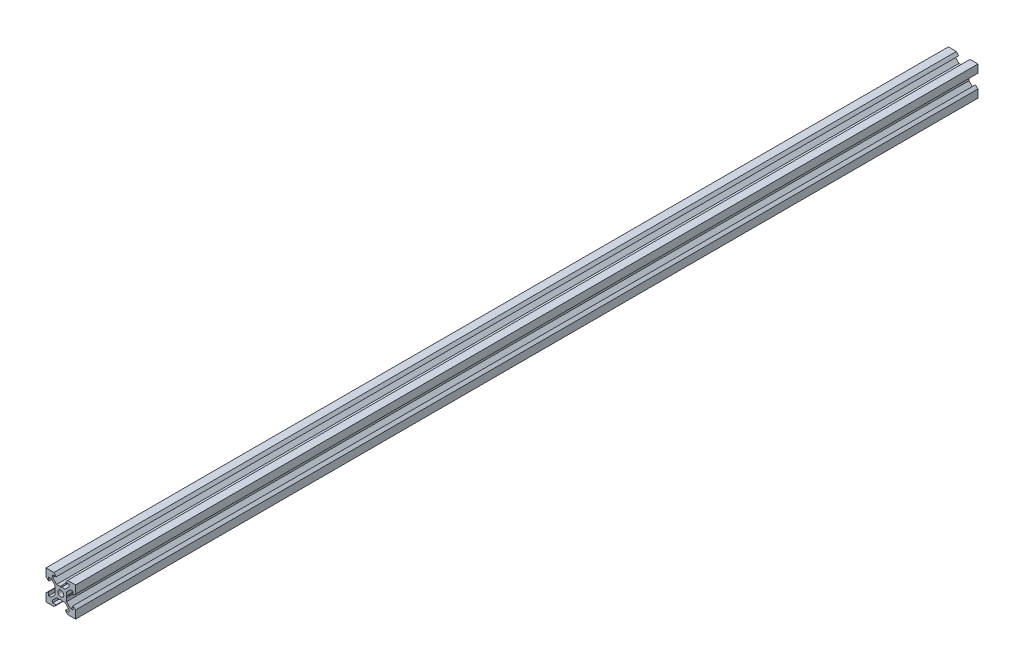
from build123d import *

# Parameters (mm, degrees)
SKETCH1_R           = 2
BOSS_EXTRUDE1_DEPTH = 304.65


with BuildPart() as part:
    # Sketch1 → Boss-Extrude1 (new, symmetric)
    with BuildSketch(Plane.XY):
        Polygon((10, 10), (10, 4.610379336), (8.2, 3.1), (8.2, 5.5), (6.560660172, 5.5), (3.9, 2.839339828), (3.9, 0.519615242), (3.6, 0), (3.9, -0.519615242), (3.9, -2.839339828), (6.560660172, -5.5), (8.2, -5.5), (8.2, -3.1), (10, -4.610379336), (10, -10), (4.610379336, -10), (3.1, -8.2), (5.5, -8.2), (5.5, -6.560660172), (2.839339828, -3.9), (0.519615242, -3.9), (0, -3.6), (-0.519615242, -3.9), (-2.839339828, -3.9), (-5.5, -6.560660172), (-5.5, -8.2), (-3.1, -8.2), (-4.610379336, -10), (-10, -10), (-10, -4.610379336), (-8.2, -3.1), (-8.2, -5.5), (-6.560660172, -5.5), (-3.9, -2.839339828), (-3.9, -0.519615242), (-3.6, 0), (-3.9, 0.519615242), (-3.9, 2.839339828), (-6.560660172, 5.5), (-8.2, 5.5), (-8.2, 3.1), (-10, 4.610379336), (-10, 10), (-4.610379336, 10), (-3.1, 8.2), (-5.5, 8.2), (-5.5, 6.560660172), (-2.839339828, 3.9), (-0.519615242, 3.9), (0, 3.6), (0.519615242, 3.9), (2.839339828, 3.9), (5.5, 6.560660172), (5.5, 8.2), (3.1, 8.2), (4.610379336, 10), align=None)
        with Locations(Location((0, 0, 0), (0, 0, 180))):
            Circle(SKETCH1_R, mode=Mode.SUBTRACT)
    extrude(amount=BOSS_EXTRUDE1_DEPTH, both=True)


solid = part.part
